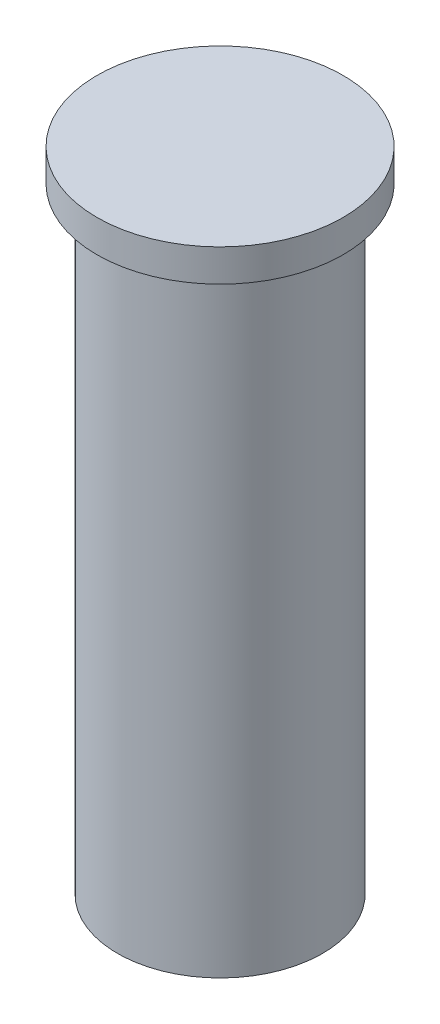
from build123d import *

# Parameters (mm, degrees)
SKETCH1_R           = 6.35
BOSS_EXTRUDE1_DEPTH = 38.1
SKETCH3_R           = 7.62
BOSS_EXTRUDE2_DEPTH = 2


with BuildPart() as part:
    # Sketch1 → Boss-Extrude1 (new body)
    with BuildSketch(Plane(origin=(0, 0, 0), x_dir=(1, 0, 0), z_dir=(0, 1, 0))):
        with Locations(Location((0, 0, 0), (0, 0, 90))):
            Circle(SKETCH1_R)
    extrude(amount=BOSS_EXTRUDE1_DEPTH)

    # Sketch3 → Boss-Extrude2 (add)
    with BuildSketch(Plane(origin=(0, 38.1, 0), x_dir=(1, 0, 0), z_dir=(0, 1, 0))):
        with Locations(Location((0, 0, 0), (0, 0, 270))):
            Circle(SKETCH3_R)
    extrude(amount=BOSS_EXTRUDE2_DEPTH)


solid = part.part
